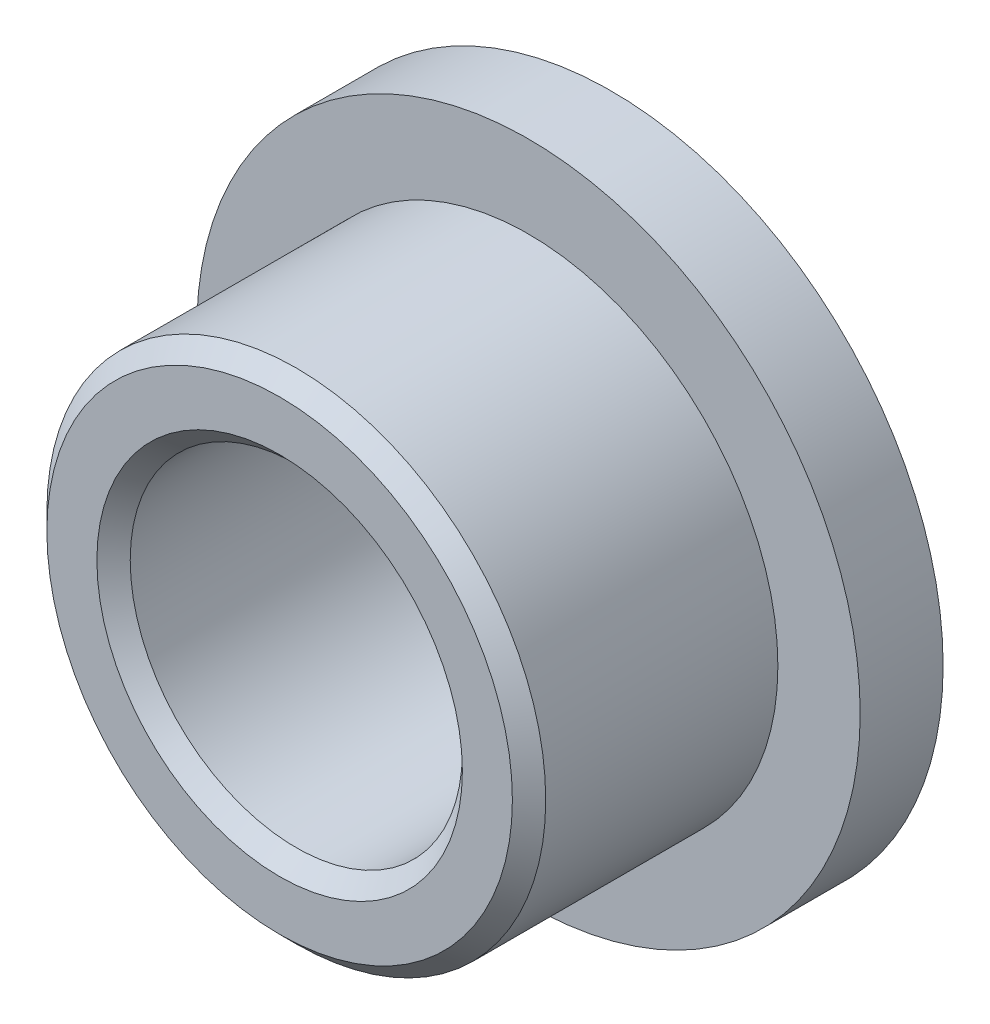
from build123d import *

# Parameters (mm, degrees)
CHAMFER1_SIZE = 0.402


with BuildPart() as part:
    # Sketch2 → Revolve1 (revolve)
    with BuildSketch(Plane(origin=(0, 0, 0), x_dir=(0, 0, -1), z_dir=(1, 0, 0)), mode=Mode.PRIVATE) as revolve1_sk:
        Polygon((-4, 4.005), (4, 4.005), (4, 8), (2, 8), (2, 6.015), (-4, 6.015), align=None)
    revolve(revolve1_sk.sketch.rotate(Axis((0, 0, 4), (0, 0, -1)), 90), axis=Axis((0, 0, 4), (0, 0, -1)))

    # Chamfer1
    chamfer1_edges = [part.edges().sort_by_distance(p)[0] for p in [
        (-4.005, 0, -4),
        (-4.005, 0, 4),
        (-6.015, 0, 4),
    ]]
    chamfer(chamfer1_edges, length=CHAMFER1_SIZE)


solid = part.part
